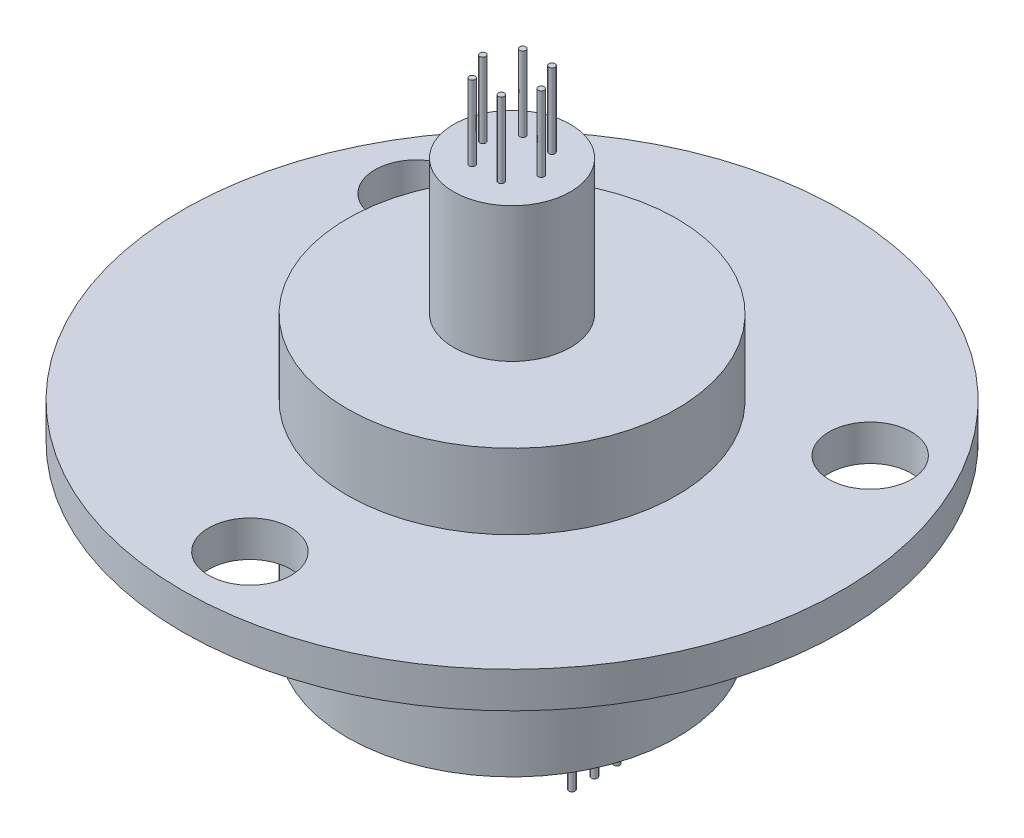
from build123d import *

# Parameters (mm, degrees)
CROQUIS1_R                = 22
CROQUIS1_R_2              = 2.75
SALIENTE_EXTRUIR1_DEPTH   = 1.2
CROQUIS3_R                = 11
SALIENTE_EXTRUIR2_DEPTH   = 5
CROQUIS4_R                = 3.9
SALIENTE_EXTRUIR3_DEPTH   = 9
SALIENTE_EXTRUIR4_START   = 11.6
CROQUIS5_R                = 11
SALIENTE_EXTRUIR4_DEPTH   = 11.6
CROQUIS6_R                = 0.2025
SALIENTE_EXTRUIR5_DEPTH   = 5
SALIENTE_EXTRUIR5_2_DEPTH = 5
SALIENTE_EXTRUIR5_3_DEPTH = 5
SALIENTE_EXTRUIR5_4_DEPTH = 5
SALIENTE_EXTRUIR5_5_DEPTH = 5
SALIENTE_EXTRUIR5_6_DEPTH = 5
CROQUIS7_R                = 0.2025
SALIENTE_EXTRUIR6_DEPTH   = 5


with BuildPart() as part:
    # Croquis1 → Saliente-Extruir1 (new, symmetric)
    with BuildSketch(Plane(origin=(0, 0, 0), x_dir=(1, 0, 0), z_dir=(0, 1, 0))):
        with Locations(Location((0, 0, 0), (0, 0, 270))):
            Circle(CROQUIS1_R)
        with Locations(Location((15.155444566, 8.75, 0), (0, 0, 270))):
            Circle(CROQUIS1_R_2, mode=Mode.SUBTRACT)
        with Locations(Location((0, -17.5, 0), (0, 0, 270))):
            Circle(CROQUIS1_R_2, mode=Mode.SUBTRACT)
        with Locations(Location((-15.155444566, 8.75, 0), (0, 0, 270))):
            Circle(CROQUIS1_R_2, mode=Mode.SUBTRACT)
    extrude(amount=SALIENTE_EXTRUIR1_DEPTH, both=True)

    # Croquis3 → Saliente-Extruir2 (add)
    with BuildSketch(Plane(origin=(0, 1.2, 0), x_dir=(1, 0, 0), z_dir=(0, 1, 0))):
        with Locations(Location((0, 0, 0), (0, 0, 270))):
            Circle(CROQUIS3_R)
    extrude(amount=SALIENTE_EXTRUIR2_DEPTH)

    # Croquis4 → Saliente-Extruir3 (add)
    with BuildSketch(Plane(origin=(0, 6.2, 0), x_dir=(1, 0, 0), z_dir=(0, 1, 0))):
        with Locations(Location((0, 0, 0), (0, 0, 270))):
            Circle(CROQUIS4_R)
    extrude(amount=SALIENTE_EXTRUIR3_DEPTH)

    # Croquis5 → Saliente-Extruir4 (add)
    with BuildSketch(Plane.XZ.offset(1.2).offset(SALIENTE_EXTRUIR4_START)):
        with Locations(Location((0, 0, 0), (0, 0, 90))):
            Circle(CROQUIS5_R)
    extrude(amount=-SALIENTE_EXTRUIR4_DEPTH)

    # Croquis7 → Saliente-Extruir6 (add)
    with BuildSketch(Plane.XZ.offset(12.8)):
        with Locations(Location((5.5, 0, 0), (0, 0, 270))):
            Circle(CROQUIS7_R)
        with Locations(Location((5.5, 1.5, 0), (0, 0, 270))):
            Circle(CROQUIS7_R)
        with Locations(Location((5.5, -1.5, 0), (0, 0, 270))):
            Circle(CROQUIS7_R)
        with Locations(Location((-5.5, -1.5, 0), (0, 0, 90))):
            Circle(CROQUIS7_R)
        with Locations(Location((-5.5, 0, 0), (0, 0, 90))):
            Circle(CROQUIS7_R)
        with Locations(Location((-5.5, 1.5, 0), (0, 0, 90))):
            Circle(CROQUIS7_R)
    extrude(amount=SALIENTE_EXTRUIR6_DEPTH)


with BuildPart() as body_2:
    # Croquis6 → Saliente-Extruir5 (new body)
    with BuildSketch(Plane(origin=(0, 15.2, 0), x_dir=(1, 0, 0), z_dir=(0, 1, 0))):
        with Locations(Location((1.95, 0, 0), (0, 0, 270))):
            Circle(CROQUIS6_R)
    extrude(amount=SALIENTE_EXTRUIR5_DEPTH)


with BuildPart() as body_3:
    # Croquis6 → Saliente-Extruir5 2 (new body)
    with BuildSketch(Plane(origin=(0, 15.2, 0), x_dir=(1, 0, 0), z_dir=(0, 1, 0))):
        with Locations(Location((0.975, -1.688749537, 0), (0, 0, 270))):
            Circle(CROQUIS6_R)
    extrude(amount=SALIENTE_EXTRUIR5_2_DEPTH)


with BuildPart() as body_4:
    # Croquis6 → Saliente-Extruir5 3 (new body)
    with BuildSketch(Plane(origin=(0, 15.2, 0), x_dir=(1, 0, 0), z_dir=(0, 1, 0))):
        with Locations(Location((-0.975, -1.688749537, 0), (0, 0, 270))):
            Circle(CROQUIS6_R)
    extrude(amount=SALIENTE_EXTRUIR5_3_DEPTH)


with BuildPart() as body_5:
    # Croquis6 → Saliente-Extruir5 4 (new body)
    with BuildSketch(Plane(origin=(0, 15.2, 0), x_dir=(1, 0, 0), z_dir=(0, 1, 0))):
        with Locations(Location((-1.95, 0, 0), (0, 0, 270))):
            Circle(CROQUIS6_R)
    extrude(amount=SALIENTE_EXTRUIR5_4_DEPTH)


with BuildPart() as body_6:
    # Croquis6 → Saliente-Extruir5 5 (new body)
    with BuildSketch(Plane(origin=(0, 15.2, 0), x_dir=(1, 0, 0), z_dir=(0, 1, 0))):
        with Locations(Location((-0.975, 1.688749537, 0), (0, 0, 270))):
            Circle(CROQUIS6_R)
    extrude(amount=SALIENTE_EXTRUIR5_5_DEPTH)


with BuildPart() as body_7:
    # Croquis6 → Saliente-Extruir5 6 (new body)
    with BuildSketch(Plane(origin=(0, 15.2, 0), x_dir=(1, 0, 0), z_dir=(0, 1, 0))):
        with Locations(Location((0.975, 1.688749537, 0), (0, 0, 270))):
            Circle(CROQUIS6_R)
    extrude(amount=SALIENTE_EXTRUIR5_6_DEPTH)


solid = Compound([part.part, body_2.part, body_3.part, body_4.part, body_5.part, body_6.part, body_7.part])
